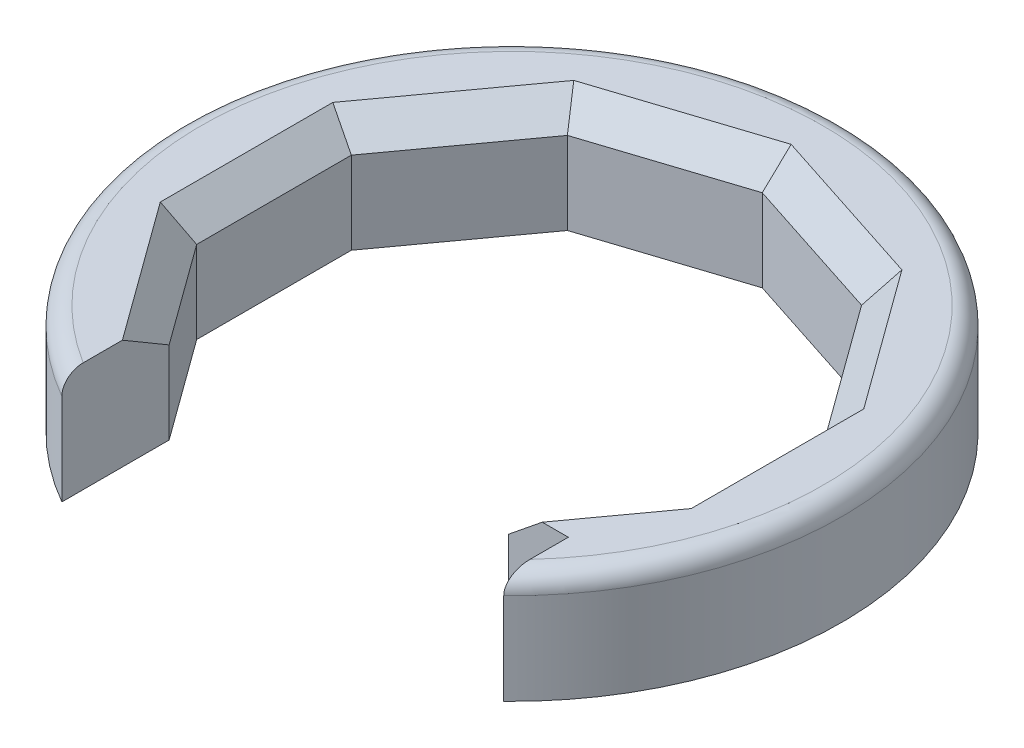
from build123d import *

# Parameters (mm, degrees)
SKETCH1_R           = 36
BOSS_EXTRUDE1_DEPTH = 12
FILLET1_R           = 2
CHAMFER1_SIZE       = 3
SKETCH2_W           = 43
SKETCH2_H           = 43
CUT_EXTRUDE2_DEPTH  = 53.306787345


with BuildPart() as part:
    # Sketch1 → Boss-Extrude1 (new body)
    with BuildSketch(Plane(origin=(0, 0, 0), x_dir=(1, 0, 0), z_dir=(0, 1, 0))):
        with Locations(Location((0, 0, 0), (0, 0, 270))):
            Circle(SKETCH1_R)
        Polygon((16.068883707, 22.116921017), (0, 27.33801783), (-16.068883707, 22.116921017), (-26, 8.447912102), (-26, -8.447912102), (-16.068883707, -22.116921017), (0, -27.33801783), (16.068883707, -22.116921017), (26, -8.447912102), (26, 8.447912102), align=None, mode=Mode.SUBTRACT)
    extrude(amount=BOSS_EXTRUDE1_DEPTH)

    # Fillet1
    fillet1_edges = [part.edges().sort_by_distance(p)[0] for p in [
        (0, 12, -36),
    ]]
    fillet(fillet1_edges, radius=FILLET1_R)

    # Chamfer1
    chamfer1_edges = [part.edges().sort_by_distance(p)[0] for p in [
        (21.034441854, 12, -15.28241656),
        (8.034441854, 12, -24.727469424),
        (-8.034441854, 12, -24.727469424),
        (-21.034441854, 12, -15.28241656),
        (-26, 12, 0),
        (-21.034441854, 12, 15.28241656),
        (-8.034441854, 12, 24.727469424),
        (8.034441854, 12, 24.727469424),
        (21.034441854, 12, 15.28241656),
        (26, 12, 0),
    ]]
    chamfer(chamfer1_edges, length=CHAMFER1_SIZE)

    # Sketch2 → Cut-Extrude2 (cut, through all)
    with BuildSketch(Plane(origin=(0, 0, 0), x_dir=(1, 0, 0), z_dir=(0, 1, 0))):
        with Locations((3.5, -40.348482004)):
            Rectangle(SKETCH2_W, SKETCH2_H)
    extrude(amount=CUT_EXTRUDE2_DEPTH, mode=Mode.SUBTRACT)


solid = part.part
